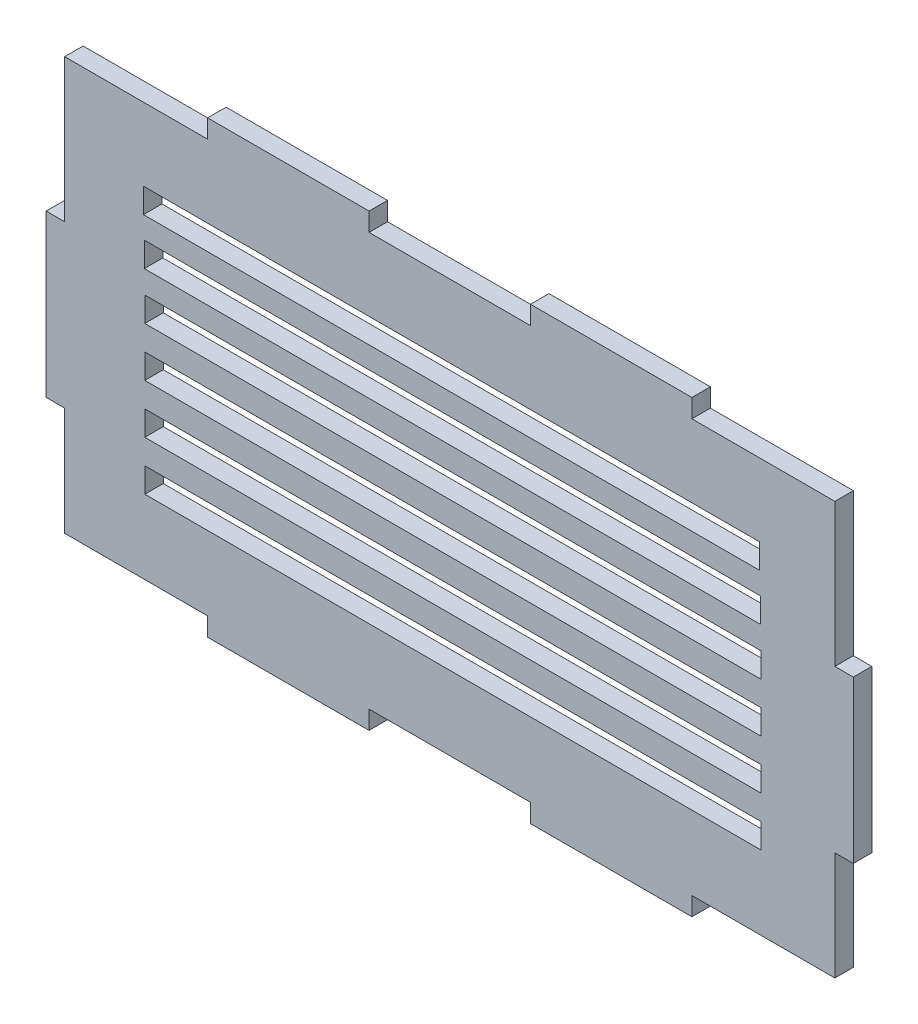
from build123d import *

# Parameters (mm, degrees)
SKETCH1_W           = 100
SKETCH1_H           = 4
BOSS_EXTRUDE1_DEPTH = 3


with BuildPart() as part:
    # Sketch1 → Boss-Extrude1 (new body)
    with BuildSketch(Plane.XY):
        Polygon((104.8, 73), (78.6, 73), (78.6, 70), (52.4, 70), (52.4, 73), (26.2, 73), (26.2, 70), (3, 70), (3, 46.8), (0, 46.8), (0, 20.6), (3, 20.6), (3, 3), (26.2, 3), (26.2, 0), (52.4, 0), (52.4, 3), (78.6, 3), (78.6, 0), (104.8, 0), (104.8, 3), (128, 3), (128, 20.6), (131, 20.6), (131, 46.8), (128, 46.8), (128, 70), (104.8, 70), align=None)
        with Locations((66, 17)):
            Rectangle(SKETCH1_W, SKETCH1_H, mode=Mode.SUBTRACT)
        with Locations((66, 25)):
            Rectangle(SKETCH1_W, SKETCH1_H, mode=Mode.SUBTRACT)
        with Locations((66, 33)):
            Rectangle(SKETCH1_W, SKETCH1_H, mode=Mode.SUBTRACT)
        with Locations((66, 41)):
            Rectangle(SKETCH1_W, SKETCH1_H, mode=Mode.SUBTRACT)
        with Locations((65.921603012, 48.672040999)):
            Rectangle(SKETCH1_W, SKETCH1_H, mode=Mode.SUBTRACT)
        with Locations((65.787326392, 56.191531722)):
            Rectangle(SKETCH1_W, SKETCH1_H, mode=Mode.SUBTRACT)
    extrude(amount=BOSS_EXTRUDE1_DEPTH)


solid = part.part
